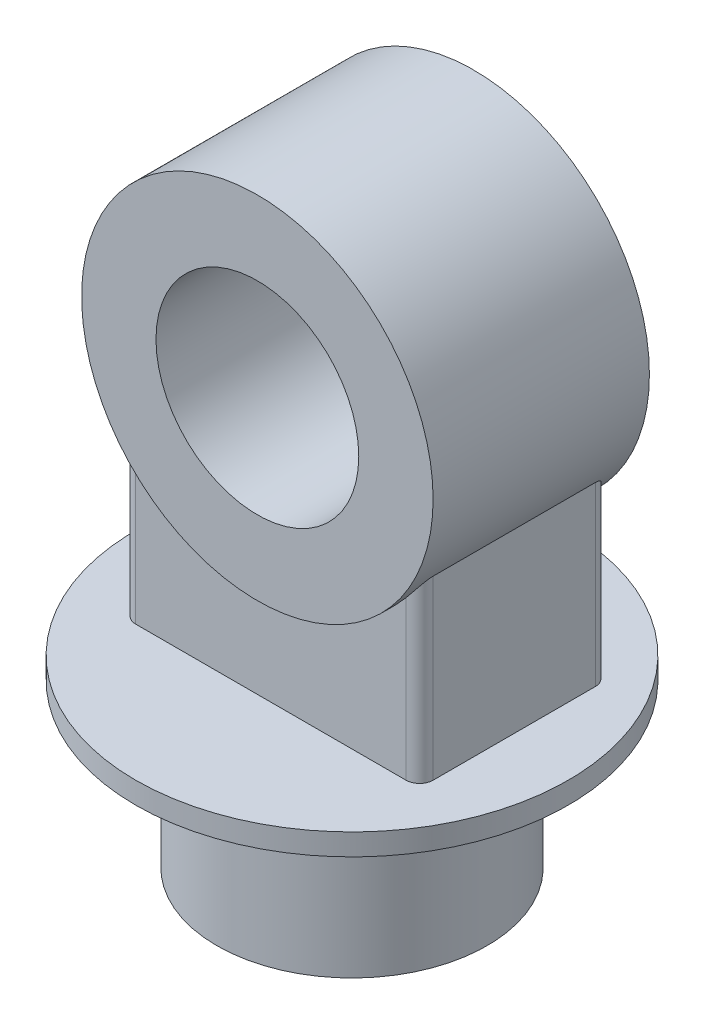
from build123d import *

# Parameters (mm, degrees)
IZIM2_R                          = 100
Y_KSEKLIK_EKSTR_ZYON1_DEPTH      = 120
IZIM3_R                          = 160
Y_KSEKLIK_EKSTR_ZYON2_DEPTH      = 16
IZIM4_R                          = 130
IZIM4_R_2                        = 75
Y_KSEKLIK_EKSTR_ZYON3_DEPTH      = 90
Y_KSEKLIK_EKSTR_ZYON4_REACH      = 402.125
Y_KSEKLIK_EKSTR_ZYON4_END_RADIUS = 130
SKETCH1_R                        = 137.362830178
SKETCH1_R_2                      = 73.465354293
CUT_EXTRUDE1_DEPTH               = 20
FILLET1_R                        = 10
FILLET2_R                        = 10


with BuildPart() as part:
    # Çizim2 → Yükseklik-Ekstrüzyon1 (new body)
    with BuildSketch(Plane(origin=(0, 0, 0), x_dir=(1, 0, 0), z_dir=(0, 1, 0))):
        with Locations(Location((0, 0, 0), (0, 0, 270))):
            Circle(IZIM2_R)
    extrude(amount=Y_KSEKLIK_EKSTR_ZYON1_DEPTH)

    # Çizim3 → Yükseklik-Ekstrüzyon2 (add)
    with BuildSketch(Plane(origin=(0, 120, 0), x_dir=(1, 0, 0), z_dir=(0, 1, 0))):
        with Locations(Location((0, 0, 0), (0, 0, 270))):
            Circle(IZIM3_R)
    extrude(amount=Y_KSEKLIK_EKSTR_ZYON2_DEPTH)



with BuildPart() as body_2:
    # Çizim4 → Yükseklik-Ekstrüzyon3 (new, symmetric)
    with BuildSketch(Plane.XY):
        with Locations(Location((0, 336, 0), (0, 0, 180))):
            Circle(IZIM4_R)
        with Locations(Location((0, 336, 0), (0, 0, 180))):
            Circle(IZIM4_R_2, mode=Mode.SUBTRACT)
    extrude(amount=Y_KSEKLIK_EKSTR_ZYON3_DEPTH, both=True)


with BuildPart() as part_1:
    add(part.part)

    add(body_2.part)  # Yükseklik-Ekstrüzyon4 merges body 2
    # Yükseklik-Ekstrüzyon4: up to this cylinder (the profile starts outside it)
    y_kseklik_ekstr_zyon4_end = Plane(origin=(0, 336, -10), z_dir=(0, 0, -1)) * Cylinder(Y_KSEKLIK_EKSTR_ZYON4_END_RADIUS, 1065.25, mode=Mode.PRIVATE)
    # Çizim6 → Yükseklik-Ekstrüzyon4 (add, up to the surface)
    with BuildSketch(Plane(origin=(0, 136, 0), x_dir=(1, 0, 0), z_dir=(0, 1, 0)), mode=Mode.PRIVATE) as y_kseklik_ekstr_zyon4_sk1:
        Polygon((107.277662826, -60), (110, -60), (110, 80), (-110, 80), (-110, -60), align=None)
    y_kseklik_ekstr_zyon4_tool1 = extrude(y_kseklik_ekstr_zyon4_sk1.sketch, amount=Y_KSEKLIK_EKSTR_ZYON4_REACH, mode=Mode.PRIVATE) - y_kseklik_ekstr_zyon4_end
    add(y_kseklik_ekstr_zyon4_tool1.solids().sort_by_distance((0, 136, -10))[0])

    # Sketch1 → Cut-Extrude1 (cut)
    with BuildSketch(Plane.XY.offset(90)):
        with Locations((0, 334.465354293)):
            Circle(SKETCH1_R)
        with Locations((0, 334.465354293)):
            Circle(SKETCH1_R_2, mode=Mode.SUBTRACT)
    extrude(amount=-CUT_EXTRUDE1_DEPTH, mode=Mode.SUBTRACT)

    # Fillet1
    fillet1_edges = [part_1.edges().sort_by_distance(p)[0] for p in [
        (-110, 201.358983849, 60),
        (110, 201.358983849, 60),
    ]]
    fillet(fillet1_edges, radius=FILLET1_R)

    # Fillet2
    fillet2_edges = [part_1.edges().sort_by_distance(p)[0] for p in [
        (110, 201.358983849, -80),
        (-110, 201.358983849, -80),
    ]]
    fillet(fillet2_edges, radius=FILLET2_R)


solid = part_1.part
